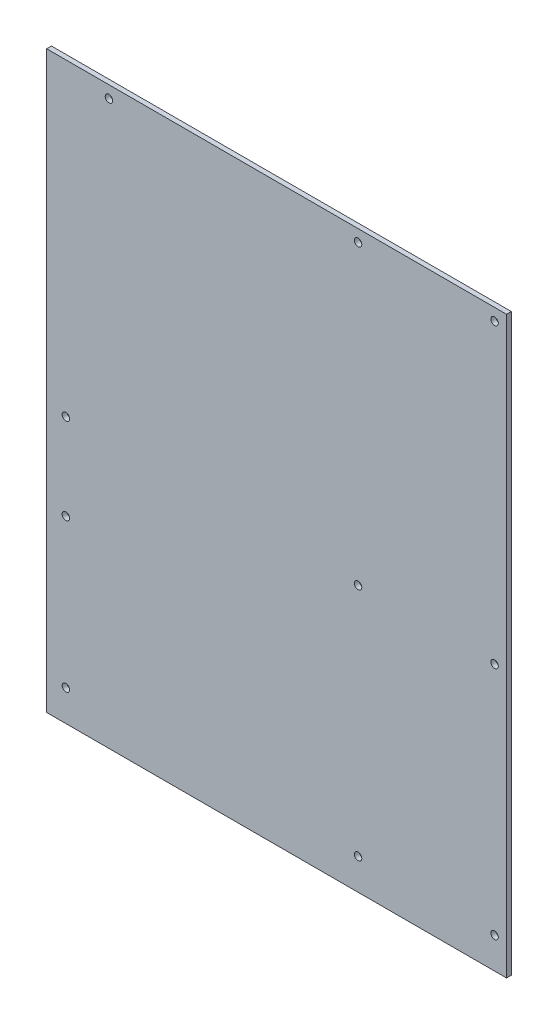
from build123d import *

# Parameters (mm, degrees)
SKETCH_1_W      = 243.84
SKETCH_1_H      = 304.8
SKETCH_1_R      = 1.9812
EXTRUDE_1_DEPTH = 2.54


with BuildPart() as part:
    # 스케치1 → 보스-돌출1 (new body)
    with BuildSketch(Plane.XY):
        with Locations((121.92, 152.4)):
            Rectangle(SKETCH_1_W, SKETCH_1_H)
        with Locations((33.02, 298.45)):
            Circle(SKETCH_1_R, mode=Mode.SUBTRACT)
        with Locations((165.1, 298.45)):
            Circle(SKETCH_1_R, mode=Mode.SUBTRACT)
        with Locations((237.49, 298.45)):
            Circle(SKETCH_1_R, mode=Mode.SUBTRACT)
        with Locations((237.49, 140.97)):
            Circle(SKETCH_1_R, mode=Mode.SUBTRACT)
        with Locations((165.1, 140.97)):
            Circle(SKETCH_1_R, mode=Mode.SUBTRACT)
        with Locations((10.16, 140.97)):
            Circle(SKETCH_1_R, mode=Mode.SUBTRACT)
        with Locations((10.16, 16.51)):
            Circle(SKETCH_1_R, mode=Mode.SUBTRACT)
        with Locations((165.1, 16.51)):
            Circle(SKETCH_1_R, mode=Mode.SUBTRACT)
        with Locations((237.49, 16.51)):
            Circle(SKETCH_1_R, mode=Mode.SUBTRACT)
        with Locations((10.16, 95.25)):
            Circle(SKETCH_1_R, mode=Mode.SUBTRACT)
    extrude(amount=EXTRUDE_1_DEPTH)


solid = part.part
